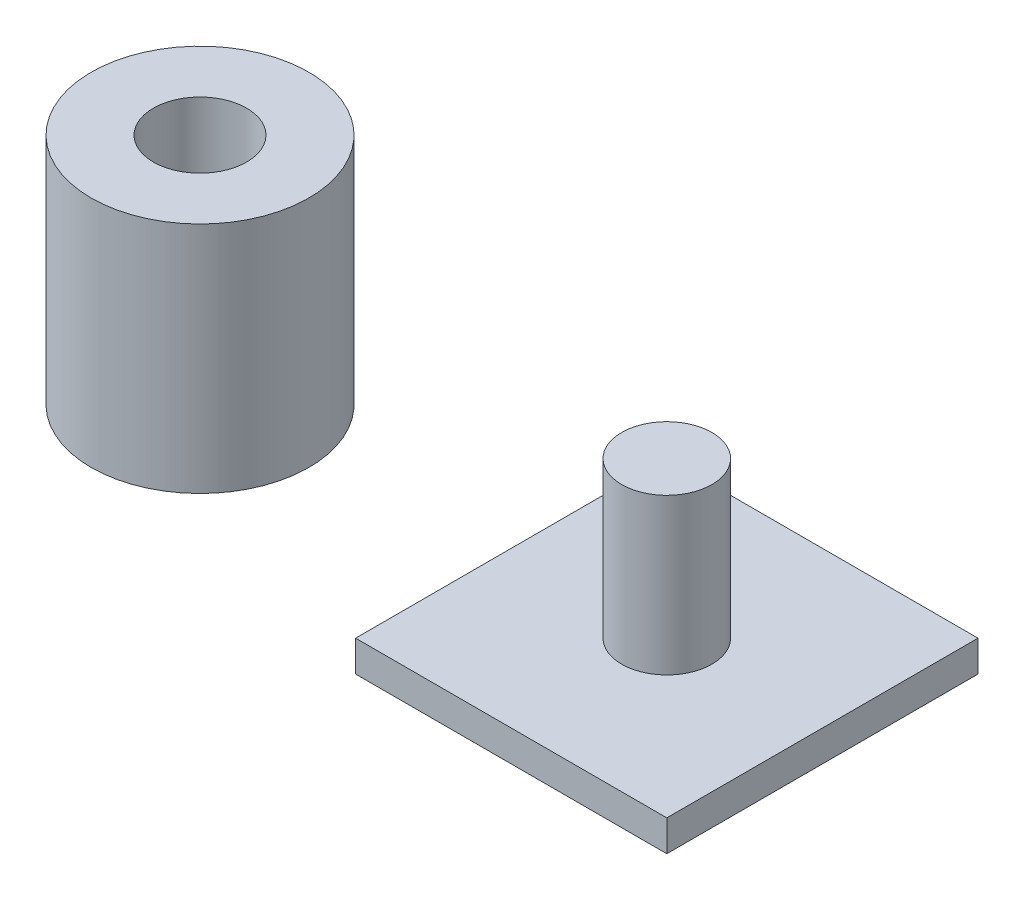
from build123d import *

# Parameters (mm, degrees)
SKETCH1_R           = 2.9
BOSS_EXTRUDE1_DEPTH = 12
SKETCH1_3_W         = 20
SKETCH1_3_H         = 20
SKETCH1_3_R         = 2.9
BOSS_EXTRUDE2_DEPTH = 2
SKETCH2_R           = 7
SKETCH2_R_2         = 3
BOSS_EXTRUDE3_DEPTH = 15


with BuildPart() as part:
    # Sketch1 → Boss-Extrude1 (new body)
    with BuildSketch(Plane(origin=(0, 0, 0), x_dir=(1, 0, 0), z_dir=(0, 1, 0))):
        Circle(SKETCH1_R)
    extrude(amount=BOSS_EXTRUDE1_DEPTH)

    # Sketch1<3> → Boss-Extrude2 (add)
    with BuildSketch(Plane(origin=(0, 0, 0), x_dir=(1, 0, 0), z_dir=(0, 1, 0))):
        Rectangle(SKETCH1_3_W, SKETCH1_3_H)
        Circle(SKETCH1_3_R, mode=Mode.SUBTRACT)
    extrude(amount=BOSS_EXTRUDE2_DEPTH)


with BuildPart() as body_2:
    # Sketch2 → Boss-Extrude3 (new body)
    with BuildSketch(Plane(origin=(0, 0, 0), x_dir=(1, 0, 0), z_dir=(0, 1, 0))):
        with Locations((-30, 0)):
            Circle(SKETCH2_R)
        with Locations((-30, 0)):
            Circle(SKETCH2_R_2, mode=Mode.SUBTRACT)
    extrude(amount=BOSS_EXTRUDE3_DEPTH)


solid = Compound([part.part, body_2.part])
